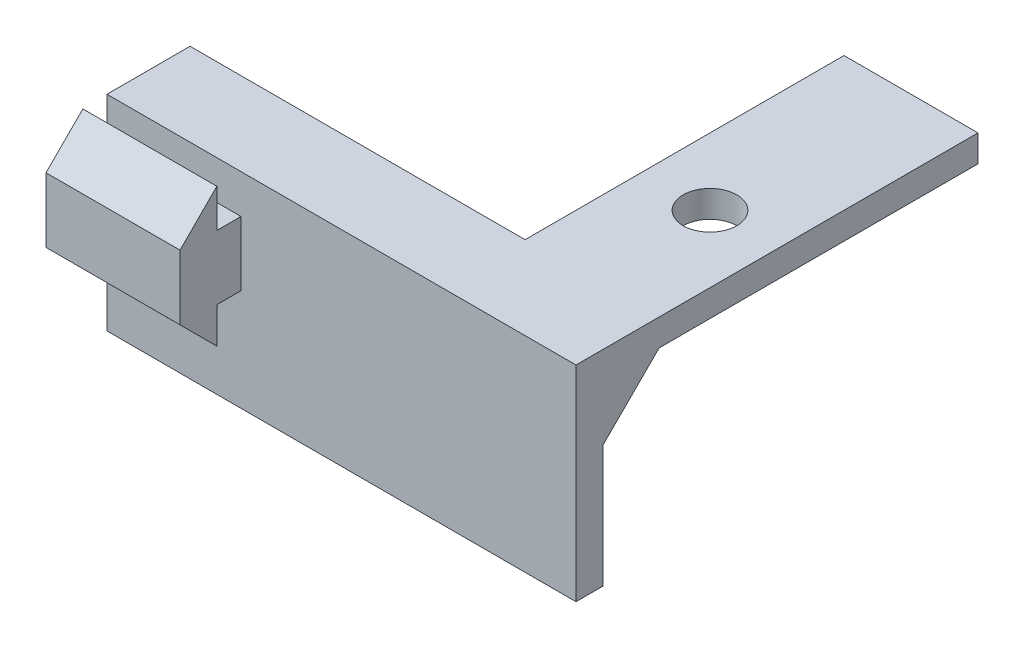
from build123d import *

# Parameters (mm, degrees)
BOSS_EXTRUDE2_DEPTH = 10
CUT_EXTRUDE9_DEPTH  = 3
BOSS_EXTRUDE3_DEPTH = 25
CUT_EXTRUDE11_DEPTH = 15


with BuildPart() as part:
    # Sketch1 → Boss-Extrude2 (new body)
    with BuildSketch(Plane(origin=(0, 0, 0), x_dir=(0, 0, -1), z_dir=(1, 0, 0))):
        Polygon((0, 0), (2, 0), (2, 9.1), (6.2, 13.3), (30, 13.3), (30, 15.3), (0, 15.3), align=None)
    extrude(amount=BOSS_EXTRUDE2_DEPTH)

    # Sketch2 → Cut-Extrude9 (cut)
    with BuildSketch(Plane(origin=(0, 15.3, 0), x_dir=(1, 0, 0), z_dir=(0, 1, 0))):
        with BuildLine():
            ThreePointArc((7, 15), (5, 17), (3, 15))
            Line((3, 15), (7, 15))
        make_face()
        with BuildLine():
            Line((7, 15), (3, 15))
            ThreePointArc((3, 15), (5, 13), (7, 15))
        make_face()
    extrude(amount=-CUT_EXTRUDE9_DEPTH, mode=Mode.SUBTRACT)

    # Sketch1<14> → Boss-Extrude3 (add)
    with BuildSketch(Plane(origin=(0, 0, 0), x_dir=(0, 0, -1), z_dir=(1, 0, 0))):
        Polygon((0, 7.6), (0, 0), (2, 0), (2, 9.1), (6.2, 13.3), (6.2, 15.3), (0, 15.3), (0, 12.4), (-1.8, 12.4), (-1.8, 15.25), (-4.55, 12.5), (-4.55, 7.671680622), (-1.8, 4.921680622), (-1.8, 7.6), align=None)
    extrude(amount=-BOSS_EXTRUDE3_DEPTH)

    # Sketch1<18> → Cut-Extrude11 (cut)
    with BuildSketch(Plane(origin=(0, 0, 0), x_dir=(0, 0, -1), z_dir=(1, 0, 0))):
        Polygon((-1.8, 7.6), (0, 7.6), (0, 12.4), (-1.8, 12.4), (-1.8, 15.25), (-4.55, 12.5), (-4.55, 7.671680622), (-1.8, 4.921680622), align=None)
    extrude(amount=-CUT_EXTRUDE11_DEPTH, mode=Mode.SUBTRACT)


solid = part.part
